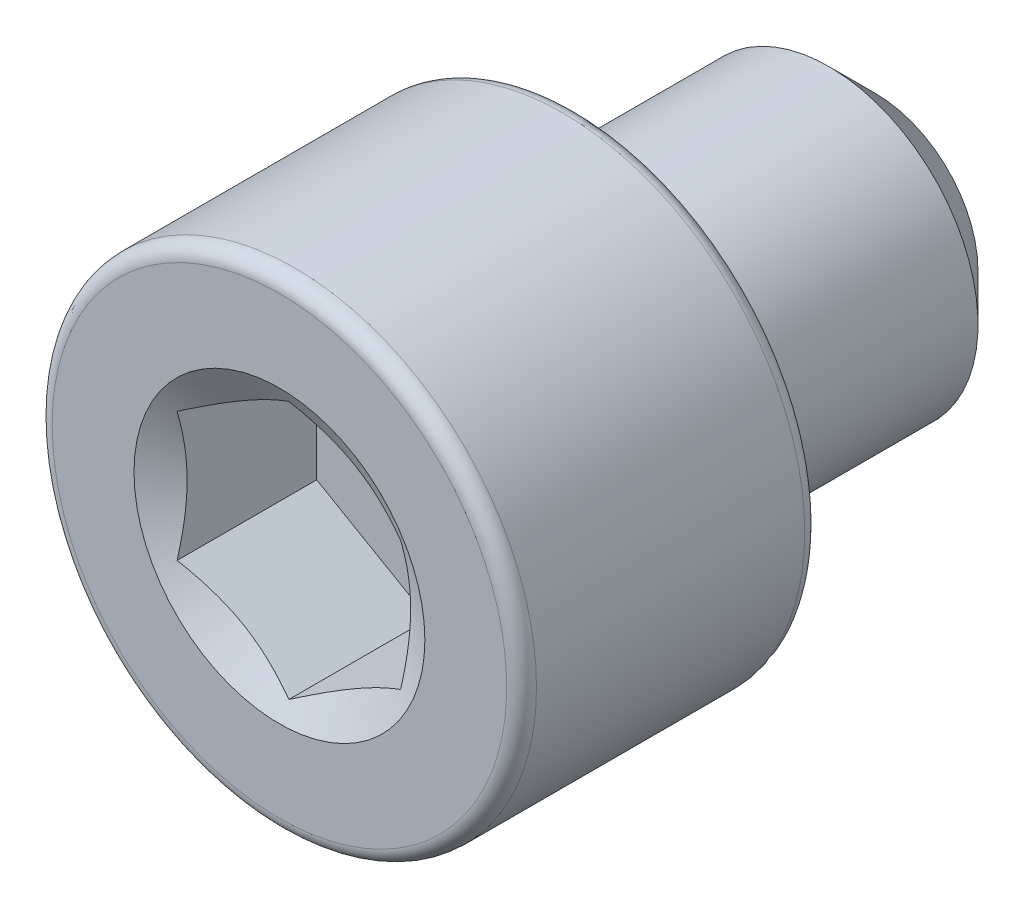
from build123d import *

# Parameters (mm, degrees)
CUT_EXTRUDE1_START = 8
CUT_EXTRUDE1_DEPTH = 4


with BuildPart() as part:
    # Sketch2 → Revolve1 (revolve)
    with BuildSketch(Plane(origin=(0, 0, 0), x_dir=(0, 0, -1), z_dir=(1, 0, 0)), mode=Mode.PRIVATE) as revolve1_sk:
        with BuildLine():
            Line((8, 0), (8, 2.75))
            Line((8, 2.75), (6.75, 4))
            Line((6.75, 4), (0, 4))
            Line((0, 4), (0, 6.1))
            ThreePointArc((0, 6.1), (-0.117157288, 6.382842712), (-0.4, 6.5))
            Line((-0.4, 6.5), (-7.6, 6.5))
            ThreePointArc((-7.6, 6.5), (-7.882842712, 6.382842712), (-8, 6.1))
            Line((-8, 6.1), (-8, 0))
            Line((-8, 0), (8, 0))
        make_face()
    revolve(revolve1_sk.sketch.rotate(Axis((0, 0, -8), (0, 0, 1)), 90), axis=Axis((0, 0, -8), (0, 0, 1)))

    # Sketch3 → Cut-Extrude1 (cut)
    with BuildSketch(Plane.XY.offset(CUT_EXTRUDE1_START)):
        Polygon((-3, 1.732050808), (-3, -1.732050808), (0, -3.464101615), (3, -1.732050808), (3, 1.732050808), (0, 3.464101615), align=None)
    extrude(amount=-CUT_EXTRUDE1_DEPTH, mode=Mode.SUBTRACT)

    # Cut-Extrude2 cone 1 section (through the dimple's axis) → Cut-Extrude2 (revolve, cut)
    with BuildSketch(Plane(origin=(0, 0, 8), x_dir=(0, -1, 0), z_dir=(1, 0, 0))):
        Polygon((0, 0), (3.903418013, 0), (0, 2.25363944), align=None)
    revolve(axis=Axis((0, 0, 8), (0, 0, -1)), mode=Mode.SUBTRACT)


solid = part.part
